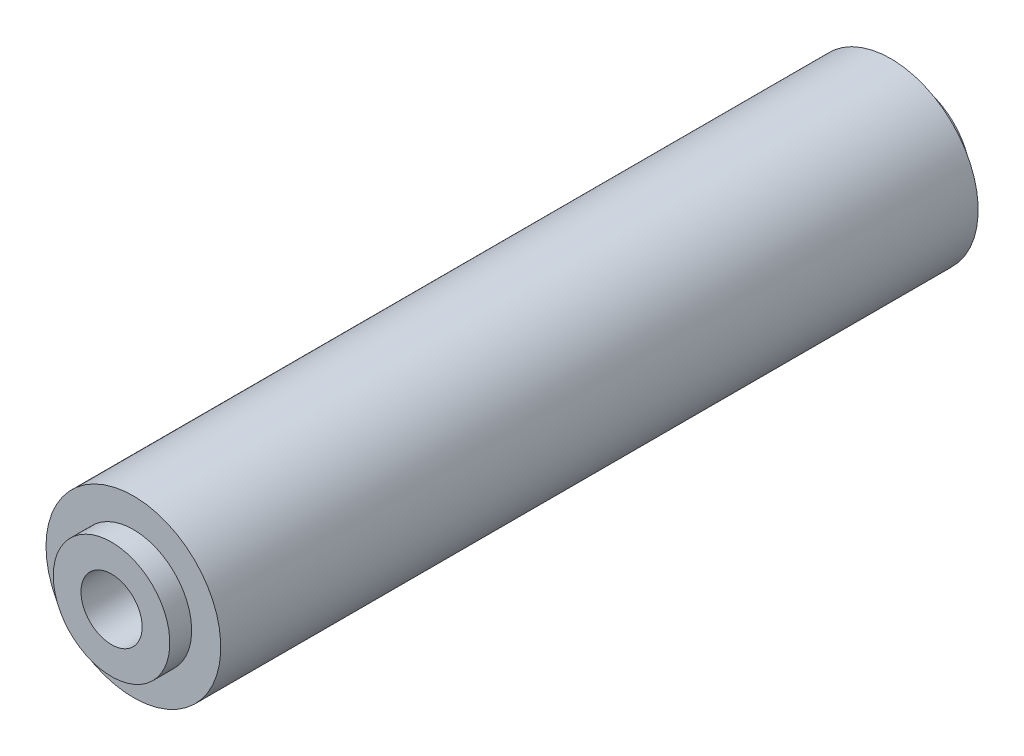
from build123d import *

# Parameters (mm, degrees)
M5X0_8_1_AT_2_COUNT = 2
M5X0_8_1_AT_2_PITCH = 90.280227073


with BuildPart() as part:
    # 草图2 → 旋转4 (revolve)
    with BuildSketch(Plane(origin=(0, 0, 0), x_dir=(0, 0, -1), z_dir=(1, 0, 0)), mode=Mode.PRIVATE) as revolve_4_sk:
        Polygon((27.5, 94), (26, 94), (26, 96), (-26, 96), (-26, 94), (-27.5, 94), (-27.5, 90), (27.5, 90), align=None)
    revolve(revolve_4_sk.sketch.rotate(Axis((0, 90, -27.5), (0, 0, 1)), 90), axis=Axis((0, 90, -27.5), (0, 0, 1)))

    # 草图5 → M5x0.8 螺纹孔的螺纹孔钻头1 (revolve, cut)
    with BuildSketch(Plane(origin=(0, 90, 27.5), x_dir=(0, -1, 0), z_dir=(1, 0, 0))):
        Polygon((0, 0), (0, 16.2618073), (2.1, 15), (2.1, 0), align=None)
    m5x0_8_1 = revolve(axis=Axis((0, 90, 33.85), (0, 0, -1)), mode=Mode.SUBTRACT)

    # M5x0.8 螺纹孔的螺纹孔钻头1 at 2: M5x0.8 螺纹孔的螺纹孔钻头1 ×2
    with Locations(*[Vector(-0.6431998246516509, -0.765698364611082, 0) * (i * M5X0_8_1_AT_2_PITCH) for i in range(1, M5X0_8_1_AT_2_COUNT)]):
        add(m5x0_8_1, mode=Mode.SUBTRACT)

    # 镜向1: M5x0.8 螺纹孔的螺纹孔钻头1 across plane
    add(m5x0_8_1.mirror(Plane.XY), mode=Mode.SUBTRACT)

    # 镜向1 copy 1 sketch → 镜向1 copy 1 (revolve, cut)
    with BuildSketch(Plane(origin=(-58.068226223, 20.872577773, -27.5), x_dir=(0, -1, 0), z_dir=(1, 0, 0))):
        Polygon((0, 0), (0, -16.2618073), (2.1, -15), (2.1, 0), align=None)
    revolve(axis=Axis((-58.068226223, 20.872577773, -33.85), (0, 0, -1)), mode=Mode.SUBTRACT)


solid = part.part
